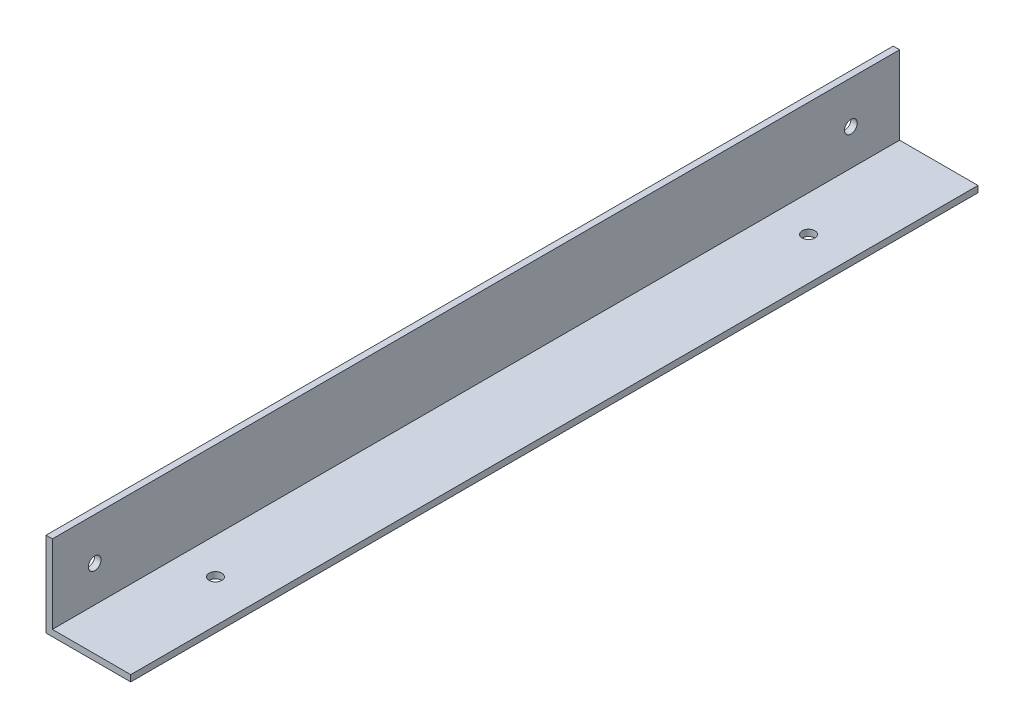
from build123d import *

# Parameters (mm, degrees)
EXTRUSION1_DEPTH = 200
ESQUISSE3_R      = 1.5
EXTRUSION3_DEPTH = 150
ESQUISSE2_R      = 1.5
EXTRUSION4_DEPTH = 100


with BuildPart() as part:
    # Esquisse1 → Extrusion1 (new body)
    with BuildSketch(Plane.XY):
        Polygon((-18.113475854, 1.818947368), (-18.113475854, -18.181052632), (1.886524146, -18.181052632), (1.886524146, -16.681052632), (-16.613475854, -16.681052632), (-16.613475854, 1.818947368), align=None)
    extrude(amount=EXTRUSION1_DEPTH)

    # Esquisse3 → Extrusion3 (cut)
    with BuildSketch(Plane(origin=(-16.613475854, 0, 0), x_dir=(0, 0, -1), z_dir=(1, 0, 0))):
        with Locations((-11.5, -8.181052632)):
            Circle(ESQUISSE3_R)
        with Locations((-190, -8.181052632)):
            Circle(ESQUISSE3_R)
    extrude(amount=-EXTRUSION3_DEPTH, mode=Mode.SUBTRACT)

    # Esquisse2 → Extrusion4 (cut)
    with BuildSketch(Plane(origin=(0, -16.681052632, 0), x_dir=(-1, 0, 0), z_dir=(0, 1, 0))):
        with Locations((8.113475854, 170)):
            Circle(ESQUISSE2_R)
        with Locations((8.113475854, 30)):
            Circle(ESQUISSE2_R)
    extrude(amount=-EXTRUSION4_DEPTH, mode=Mode.SUBTRACT)


solid = part.part
